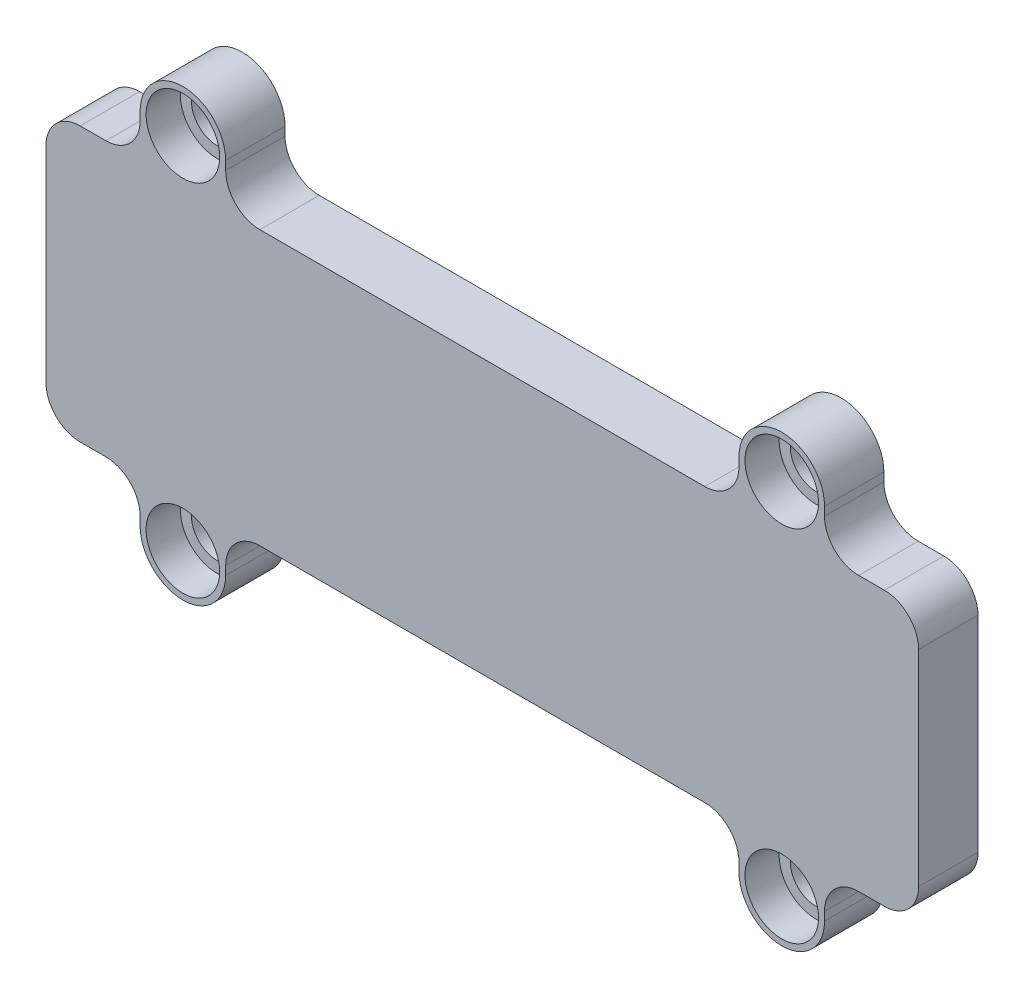
from build123d import *

# Parameters (mm, degrees)
EXTRUDE_1_DEPTH     = 3.47
FILLET_1_R          = 2
MM_1_D              = 3
MM_1_CSINK_D        = 3.05
MM_1_CSINK_ANGLE    = 90
SKETCH_5_R          = 2.15
CUT_EXTRUDE_1_DEPTH = 2


with BuildPart() as part:
    # 草图1 → 凸台-拉伸1 (new body)
    with BuildSketch(Plane.XY):
        with BuildLine():
            Line((-25.5, -8), (-20, -8))
            Line((-20, -8), (-20, -10.5))
            ThreePointArc((-20, -10.5), (-17.5, -13), (-15, -10.5))
            Line((-15, -10.5), (-15, -8))
            Line((-15, -8), (15, -8))
            Line((15, -8), (15, -10.5))
            ThreePointArc((15, -10.5), (17.5, -13), (20, -10.5))
            Line((20, -10.5), (20, -8))
            Line((20, -8), (25.5, -8))
            Line((25.5, -8), (25.5, 8))
            Line((25.5, 8), (20, 8))
            Line((20, 8), (20, 10.5))
            ThreePointArc((20, 10.5), (17.5, 13), (15, 10.5))
            Line((15, 10.5), (15, 8))
            Line((15, 8), (-15, 8))
            Line((-15, 8), (-15, 10.5))
            ThreePointArc((-15, 10.5), (-17.5, 13), (-20, 10.5))
            Line((-20, 10.5), (-20, 8))
            Line((-20, 8), (-25.5, 8))
            Line((-25.5, 8), (-25.5, -8))
        make_face()
    extrude(amount=EXTRUDE_1_DEPTH)

    # 圆角1
    fillet_1_edges = [part.edges().sort_by_distance(p)[0] for p in [
        (25.5, 8, 1.735),
        (25.5, -8, 1.735),
        (20, -8, 1.735),
        (15, -8, 1.735),
        (-15, -8, 1.735),
        (-20, -8, 1.735),
        (-25.5, -8, 1.735),
        (-25.5, 8, 1.735),
        (-20, 8, 1.735),
        (-15, 8, 1.735),
        (15, 8, 1.735),
        (20, 8, 1.735),
    ]]
    fillet(fillet_1_edges, radius=FILLET_1_R)

    # 大小mm 暗销孔1 (through all)
    with Locations(Plane.XY.offset(3.47)):
        with Locations((-17.5, 10.5), (-17.5, -10.5), (17.5, -10.5), (17.5, 10.5)):
            CounterSinkHole(MM_1_D / 2, MM_1_CSINK_D / 2, counter_sink_angle=MM_1_CSINK_ANGLE)

    # 草图5 → 切除-拉伸1 (cut)
    with BuildSketch(Plane.XY.offset(3.47)):
        with Locations((-17.5, 10.5)):
            Circle(SKETCH_5_R)
        with Locations((17.5, 10.5)):
            Circle(SKETCH_5_R)
        with Locations((-17.5, -10.5)):
            Circle(SKETCH_5_R)
        with Locations((17.5, -10.5)):
            Circle(SKETCH_5_R)
    extrude(amount=-CUT_EXTRUDE_1_DEPTH, mode=Mode.SUBTRACT)


solid = part.part
